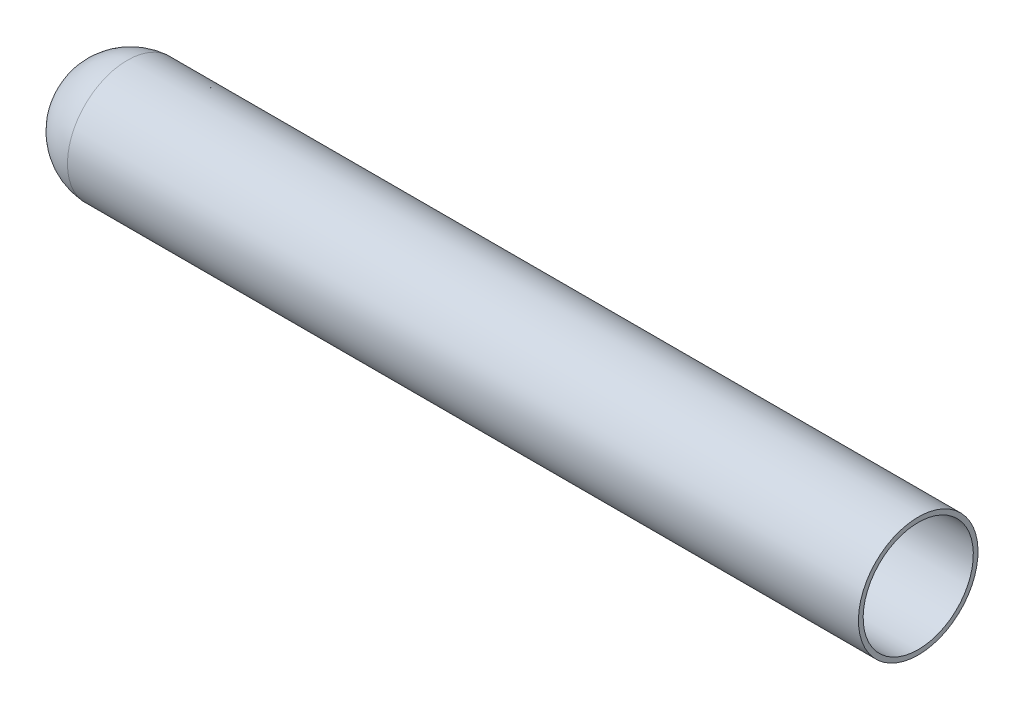
from build123d import *


with BuildPart() as part:
    # Çizim1 → Döndür1 (revolve)
    with BuildSketch(Plane.XY):
        with BuildLine():
            Line((45, 3.175), (3, 3.175))
            ThreePointArc((3, 3.175), (0.86863142, 2.184068737), (0, 0))
            Line((0, 0), (0.25, 0))
            ThreePointArc((0.25, 0), (1.047963304, 2.0098472), (3.007230145, 2.925))
            Line((3.007230145, 2.925), (45, 2.925))
            Line((45, 2.925), (45, 3.175))
        make_face()
    revolve(axis=Axis((0.25, 0, 0), (1, 0, 0)))


solid = part.part
